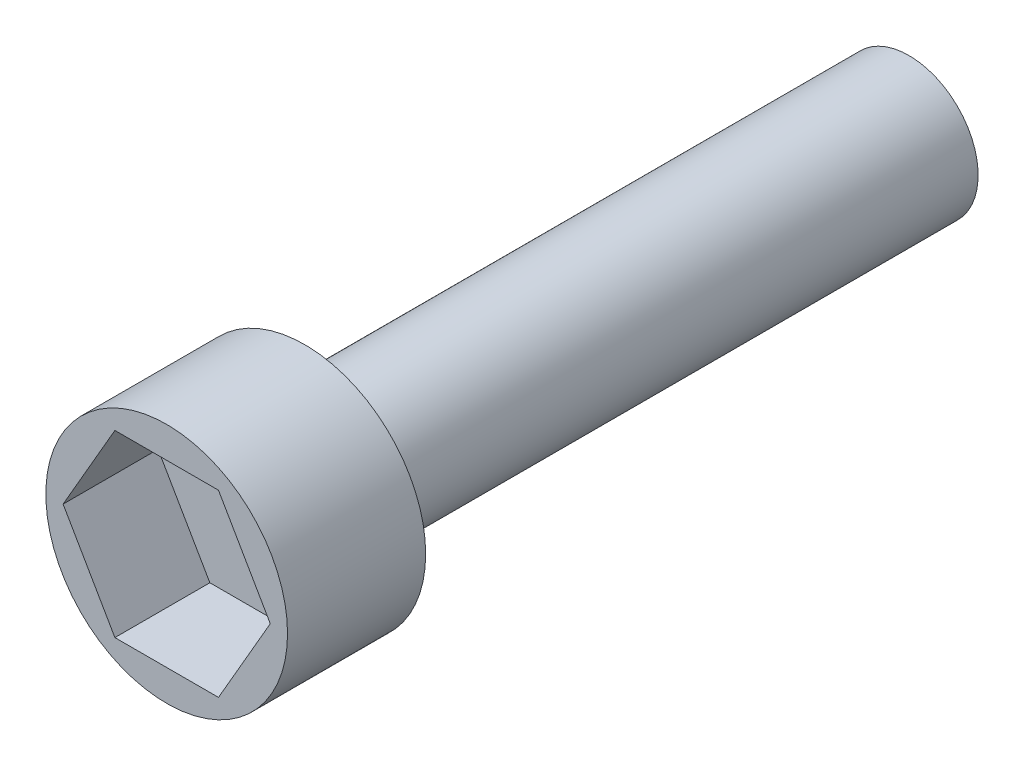
from build123d import *

# Parameters (mm, degrees)
SKETCH1_W           = 177.8
SKETCH1_H           = 203.2
SKETCH2_R           = 101.6
BOSS_EXTRUDE1_DEPTH = 889
CUT_EXTRUDE1_DEPTH  = 139.7


with BuildPart() as part:
    # Sketch1 → Revolve1 (revolve)
    with BuildSketch(Plane(origin=(0, 0, 0), x_dir=(1, 0, 0), z_dir=(0, 1, 0))):
        with Locations((88.9, -990.6)):
            Rectangle(SKETCH1_W, SKETCH1_H)
    revolve(axis=Axis((0, 0, 889), (0, 0, 1)))

    # Sketch2 → Boss-Extrude1 (add)
    with BuildSketch(Plane(origin=(0, 0, 889), x_dir=(-1, 0, 0), z_dir=(0, 0, -1))):
        Circle(SKETCH2_R)
    extrude(amount=BOSS_EXTRUDE1_DEPTH)

    # Sketch3 → Cut-Extrude1 (cut)
    with BuildSketch(Plane.XY.offset(1092.2)):
        Polygon((-152.4, 0), (-76.2, -131.982271537), (76.2, -131.982271537), (152.4, 0), (76.2, 131.982271537), (-76.2, 131.982271537), align=None)
    extrude(amount=-CUT_EXTRUDE1_DEPTH, mode=Mode.SUBTRACT)


solid = part.part
